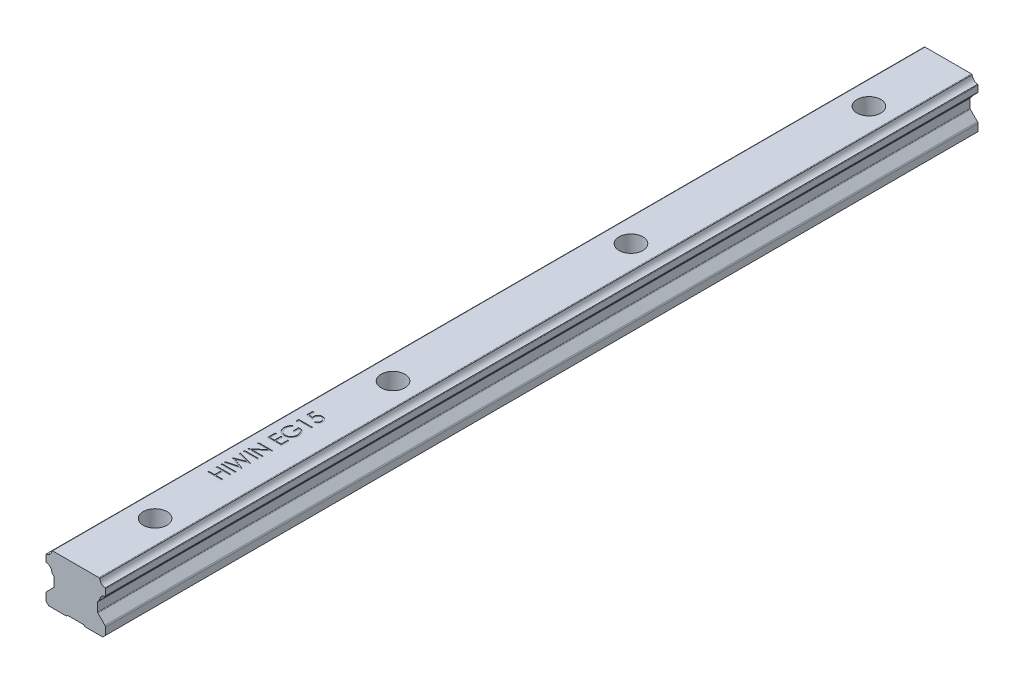
from build123d import *

# Parameters (mm, degrees)
EXTRUDE_1_DEPTH              = 220
HOLE_WIZARD_M3_1_D           = 3.5
HOLE_WIZARD_M3_1_CBORE_D     = 6
HOLE_WIZARD_M3_1_CBORE_DEPTH = 4.5
PATTERN_LINEAR_1_COUNT       = 4
PATTERN_LINEAR_1_PITCH       = 60
SKETCH_6_W                   = 3.5
SKETCH_6_H                   = 0.314102564
CUT_EXTRUDE_1_DEPTH          = 0.1


with BuildPart() as part:
    # 草图1 → 凸台-拉伸1 (new body)
    with BuildSketch(Plane.XY):
        with BuildLine():
            Line((7.5, 9.369442683), (7.5, 10.830565317))
            ThreePointArc((7.5, 10.830565317), (7.479698939, 10.939048053), (7.421543308, 11.032848691))
            ThreePointArc((7.421543308, 11.032848691), (6.468331206, 11.468335206), (6.03284469, 12.421547308))
            ThreePointArc((6.03284469, 12.421547308), (5.939044052, 12.479702939), (5.830561317, 12.500004))
            Line((5.830561317, 12.500004), (-5.830561317, 12.500004))
            ThreePointArc((-5.830561317, 12.500004), (-5.939044052, 12.479702939), (-6.03284469, 12.421547308))
            ThreePointArc((-6.03284469, 12.421547308), (-6.468331206, 11.468335206), (-7.421543307, 11.03284869))
            ThreePointArc((-7.421543307, 11.03284869), (-7.479698938, 10.939048053), (-7.5, 10.830565317))
            Line((-7.5, 10.830565317), (-7.5, 9.369442683))
            ThreePointArc((-7.5, 9.369442683), (-7.479698938, 9.260959948), (-7.421543307, 9.16715931))
            ThreePointArc((-7.421543307, 9.16715931), (-6.419021805, 8.6799564), (-6.029408747, 7.635629965))
            Line((-6.029408747, 7.635629965), (-5.58786755, 7.194087041))
            ThreePointArc((-5.58786755, 7.194087041), (-5.522836028, 7.09676018), (-5.5, 6.981955422))
            Line((-5.5, 6.981955422), (-5.5, 4.824263469))
            ThreePointArc((-5.5, 4.824263469), (-5.52283614, 4.709458439), (-5.587867966, 4.612131434))
            Line((-5.587867966, 4.612131434), (-7.353553391, 2.846446009))
            ThreePointArc((-7.353553391, 2.846446009), (-7.461939766, 2.684234335), (-7.5, 2.492892619))
            Line((-7.5, 2.492892619), (-7.5, 0.700010907))
            Line((-7.5, 0.700010907), (-6.79998907, 0))
            Line((-6.79998907, 0), (-2.3500088, 0))
            Line((-2.3500088, 0), (-2.05000999, 0.29999924))
            Line((-2.05000999, 0.29999924), (2.05000999, 0.29999924))
            Line((2.05000999, 0.29999924), (2.3500088, 0))
            Line((2.3500088, 0), (6.79998907, 0))
            Line((6.79998907, 0), (7.5, 0.700010907))
            Line((7.5, 0.700010907), (7.5, 2.492892619))
            ThreePointArc((7.5, 2.492892619), (7.461939766, 2.684234335), (7.353553391, 2.84644601))
            Line((7.353553391, 2.84644601), (5.587867966, 4.612131434))
            ThreePointArc((5.587867966, 4.612131434), (5.522836141, 4.709458439), (5.5, 4.824263469))
            Line((5.5, 4.824263469), (5.5, 6.981955422))
            ThreePointArc((5.5, 6.981955422), (5.522836028, 7.09676018), (5.587867551, 7.194087041))
            Line((5.587867551, 7.194087041), (6.029408747, 7.635629965))
            ThreePointArc((6.029408747, 7.635629965), (6.419021805, 8.6799564), (7.421543308, 9.16715931))
            ThreePointArc((7.421543308, 9.16715931), (7.479698939, 9.260959948), (7.5, 9.369442683))
        make_face()
    extrude(amount=-EXTRUDE_1_DEPTH)

    # M3 六角凹头螺钉的柱形沉头孔1 (through all)
    with Locations(Plane(origin=(1.396551685, 12.500004, 9.221659416), x_dir=(-1, 0, 0), z_dir=(0, 1, 0))):
        with Locations((1.396551685, -29.221659416)):
            hole_wizard_m3_1 = CounterBoreHole(HOLE_WIZARD_M3_1_D / 2, HOLE_WIZARD_M3_1_CBORE_D / 2, HOLE_WIZARD_M3_1_CBORE_DEPTH)

    # 阵列(线性)1: M3 六角凹头螺钉的柱形沉头孔1 ×4
    with Locations(*[(0, 0, -i * PATTERN_LINEAR_1_PITCH) for i in range(1, PATTERN_LINEAR_1_COUNT)]):
        add(hole_wizard_m3_1, mode=Mode.SUBTRACT)

    # 草图6 → 切除-拉伸1 (cut)
    with BuildSketch(Plane(origin=(0, 12.500004, 0), x_dir=(1, 0, 0), z_dir=(0, 1, 0))):
        Polygon((-3.5, 36.762820513), (-3.5, 37.076923077), (-2.064102564, 37.076923077), (-2.064102564, 38.871794872), (-3.5, 38.871794872), (-3.5, 39.185897436), (0, 39.185897436), (0, 38.871794872), (-1.705128205, 38.871794872), (-1.705128205, 37.076923077), (0, 37.076923077), (0, 36.762820513), align=None)
        with Locations((-1.75, 40.240384615)):
            Rectangle(SKETCH_6_W, SKETCH_6_H)
        Polygon((-3.5, 40.935897436), (-3.5, 41.260516827), (-0.933193109, 41.945512821), (-3.5, 42.964242788), (-3.5, 43.009815705), (-0.950721154, 44.009615385), (-3.5, 44.698116987), (-3.5, 45.019230769), (0, 44.075520833), (0, 44.030649038), (-2.676883013, 42.977564103), (0, 41.911858974), (0, 41.866987179), align=None)
        with Locations((-1.75, 45.983974359)):
            Rectangle(SKETCH_6_W, SKETCH_6_H)
        Polygon((0, 46.903846154), (-3.5, 46.903846154), (-3.5, 46.969751603), (-0.745292468, 49.282051282), (-3.5, 49.282051282), (-3.5, 49.596153846), (0, 49.596153846), (0, 49.524639423), (-2.748397436, 47.217948718), (0, 47.217948718), align=None)
        Polygon((-3.5, 51.83974359), (-3.5, 53.814102564), (-3.141025641, 53.814102564), (-3.141025641, 52.153846154), (-2.064102564, 52.153846154), (-2.064102564, 53.814102564), (-1.705128205, 53.814102564), (-1.705128205, 52.153846154), (-0.358974359, 52.153846154), (-0.358974359, 53.814102564), (0, 53.814102564), (0, 51.83974359), align=None)
        with BuildLine():
            Line((-2.902644231, 57.717948718), (-2.647435897, 57.448717949))
            add(Edge.make_bspline(
                [(-2.647435897, 57.448717949), (-2.69328212, 57.400008868), (-2.783881335, 57.303752203), (-2.901244074, 57.146552261), (-3.002777003, 56.983196408), (-3.084772592, 56.813420508), (-3.149094254, 56.641676508), (-3.195850217, 56.470917554), (-3.225460377, 56.302249256), (-3.229016796, 56.190084954), (-3.230769231, 56.134815705)],
                knots=[0, 0, 0, 0, 1.089067066, 2.152164705, 3.18986567, 4.218445106, 5.218487318, 6.173592265, 7.100032889, 8, 8, 8, 8], degree=3))
            add(Edge.make_bspline(
                [(-3.230769231, 56.134815705), (-3.230355625, 56.100901005), (-3.229529486, 56.033159565), (-3.218985271, 55.932537621), (-3.203820407, 55.832970983), (-3.181878529, 55.734647609), (-3.15406947, 55.637376321), (-3.119284004, 55.541495434), (-3.078728771, 55.446826062), (-3.031866252, 55.354260043), (-2.980386575, 55.26451931), (-2.923337414, 55.179763314), (-2.862550889, 55.099446852), (-2.796491613, 55.025097645), (-2.725807311, 54.956221131), (-2.651770944, 54.89155043), (-2.572926872, 54.832290852), (-2.489599321, 54.779505212), (-2.403726867, 54.731837618), (-2.316037795, 54.690645418), (-2.227346143, 54.654835464), (-2.136984078, 54.627561503), (-2.045883197, 54.604460629), (-1.953566086, 54.588379393), (-1.859791669, 54.579283076), (-1.796993971, 54.577712585), (-1.765424679, 54.576923077)],
                knots=[0, 0, 0, 0, 1.028150113, 2.053633673, 3.06513288, 4.081487945, 5.106702018, 6.131327874, 7.172780699, 8.228344599, 9.276313556, 10.308389736, 11.324843658, 12.329040066, 13.321460474, 14.316307835, 15.308626991, 16.309440696, 17.305625405, 18.28535951, 19.246194545, 20.203493668, 21.145557131, 22.095268976, 23.042464743, 24, 24, 24, 24], degree=3))
            add(Edge.make_bspline(
                [(-1.765424679, 54.576923077), (-1.733154018, 54.577679272), (-1.668700816, 54.579189598), (-1.572504414, 54.588842795), (-1.477747832, 54.606798005), (-1.384282029, 54.630609755), (-1.291920993, 54.66088243), (-1.20076111, 54.698074944), (-1.110811241, 54.742381076), (-1.022964324, 54.793552345), (-0.937464192, 54.850061813), (-0.856251713, 54.912212997), (-0.780271995, 54.980110534), (-0.708415252, 55.052509477), (-0.641134974, 55.130069473), (-0.579242122, 55.213543005), (-0.521779643, 55.301761597), (-0.469378807, 55.394764386), (-0.42257144, 55.491568366), (-0.38094723, 55.590824797), (-0.346667976, 55.692852699), (-0.31872985, 55.797115365), (-0.295829559, 55.903488643), (-0.281097077, 56.012512444), (-0.270406246, 56.123385153), (-0.269624576, 56.198123785), (-0.269230769, 56.235777244)],
                knots=[0, 0, 0, 0, 0.935915162, 1.869274651, 2.799799983, 3.730201895, 4.664668062, 5.616159355, 6.583070886, 7.570012957, 8.562524459, 9.553461134, 10.53281078, 11.515274572, 12.509912756, 13.507571325, 14.526460018, 15.561318395, 16.601025881, 17.643204557, 18.680545676, 19.719612342, 20.772381578, 21.833430283, 22.908478249, 24, 24, 24, 24], degree=3))
            add(Edge.make_bspline(
                [(-0.269230769, 56.235777244), (-0.270178952, 56.281155776), (-0.272040863, 56.370263896), (-0.286546735, 56.501247716), (-0.309173205, 56.627060334), (-0.342412256, 56.747292172), (-0.384484705, 56.862379567), (-0.436513285, 56.971898055), (-0.497950569, 57.076150049), (-0.567552463, 57.174684309), (-0.645100929, 57.26515833), (-0.728035637, 57.347500409), (-0.817431068, 57.418879031), (-0.911954918, 57.481426348), (-1.012511326, 57.533123592), (-1.118540888, 57.57556947), (-1.230109213, 57.608101926), (-1.307200733, 57.621457015), (-1.346153846, 57.628205128)],
                knots=[0, 0, 0, 0, 1.130199668, 2.219330667, 3.279027493, 4.311506524, 5.322739849, 6.327972234, 7.327472899, 8.33386792, 9.329086447, 10.29244429, 11.240784345, 12.174119183, 13.111530729, 14.052100829, 15.015757696, 16, 16, 16, 16], degree=3))
            Line((-1.346153846, 57.628205128), (-1.346153846, 56.461538462))
            Line((-1.346153846, 56.461538462), (-1.705128205, 56.461538462))
            Line((-1.705128205, 56.461538462), (-1.705128205, 57.942307692))
            add(Edge.make_bspline(
                [(-1.705128205, 57.942307692), (-1.638220716, 57.940601844), (-1.507270675, 57.937263191), (-1.316300404, 57.913844275), (-1.13592871, 57.876027763), (-0.965965639, 57.824367451), (-0.806652046, 57.75749217), (-0.65782618, 57.676119642), (-0.520449499, 57.578947521), (-0.393400495, 57.469437079), (-0.280071283, 57.346537122), (-0.180465345, 57.213568502), (-0.09656273, 57.070311533), (-0.028302067, 56.916901726), (0.024971927, 56.753841292), (0.062743504, 56.580752913), (0.085373467, 56.397871312), (0.088264847, 56.272534635), (0.08974359, 56.208433494)],
                knots=[0, 0, 0, 0, 1.140356446, 2.231883559, 3.274166699, 4.278491846, 5.25512956, 6.21435461, 7.1637429, 8.11826594, 9.068280886, 10.0076534, 10.945064095, 11.891975133, 12.864533718, 13.863980011, 14.907571808, 16, 16, 16, 16], degree=3))
            add(Edge.make_bspline(
                [(0.08974359, 56.208433494), (0.089174469, 56.168923358), (0.088051978, 56.090996637), (0.080074631, 55.975905709), (0.067794054, 55.863988089), (0.049248931, 55.75526008), (0.026534277, 55.649321738), (-0.002552442, 55.546702153), (-0.036221141, 55.447010411), (-0.074516815, 55.350092425), (-0.118888472, 55.256827878), (-0.168198111, 55.166801361), (-0.222191472, 55.079515236), (-0.281802318, 54.995564071), (-0.346584778, 54.914510449), (-0.416668697, 54.836877005), (-0.491839816, 54.762229127), (-0.545218826, 54.715468664), (-0.572115385, 54.691907051)],
                knots=[0, 0, 0, 0, 1.107784379, 2.184907829, 3.233506516, 4.263428166, 5.276301166, 6.270063455, 7.25232949, 8.225834625, 9.190232166, 10.146266622, 11.1027726, 12.066435141, 13.031522626, 14.010570082, 14.99756817, 16, 16, 16, 16], degree=3))
            add(Edge.make_bspline(
                [(-0.572115385, 54.691907051), (-0.614786038, 54.657721119), (-0.699419055, 54.589916707), (-0.835018999, 54.50263855), (-0.975420859, 54.428237147), (-1.121015488, 54.367869325), (-1.271666701, 54.320731239), (-1.427181992, 54.286924986), (-1.587761622, 54.267117697), (-1.696426887, 54.264264159), (-1.751402244, 54.262820513)],
                knots=[0, 0, 0, 0, 1.023165419, 2.029347347, 3.013907458, 3.994755782, 4.975994455, 5.96558838, 6.970761222, 8, 8, 8, 8], degree=3))
            add(Edge.make_bspline(
                [(-1.751402244, 54.262820513), (-1.792568496, 54.263352751), (-1.874377804, 54.264410462), (-1.99583511, 54.27723598), (-2.115135808, 54.295637392), (-2.232182344, 54.322684468), (-2.347053012, 54.356780654), (-2.45980069, 54.399334435), (-2.570493643, 54.448878213), (-2.67836343, 54.50646793), (-2.782003044, 54.570536667), (-2.880905313, 54.640144323), (-2.973467332, 54.715828008), (-3.059903521, 54.797808103), (-3.141494975, 54.884432033), (-3.216537375, 54.977518334), (-3.286205011, 55.07565667), (-3.349159221, 55.17960781), (-3.405727075, 55.287731441), (-3.455315154, 55.399792527), (-3.496298775, 55.515750345), (-3.531072472, 55.634737902), (-3.556787635, 55.757655381), (-3.575436374, 55.883610924), (-3.588196976, 56.013261034), (-3.589223231, 56.100897064), (-3.58974359, 56.145332532)],
                knots=[0, 0, 0, 0, 1.00895651, 2.005089799, 2.991467152, 3.967318338, 4.948153826, 5.927364234, 6.919980553, 7.91976625, 8.923240147, 9.905815003, 10.88314567, 11.851989312, 12.825009789, 13.798721852, 14.781296708, 15.773896486, 16.776076962, 17.771600213, 18.775744723, 19.78957137, 20.808953803, 21.851964491, 22.910847925, 24, 24, 24, 24], degree=3))
            add(Edge.make_bspline(
                [(-3.58974359, 56.145332532), (-3.589164098, 56.181570776), (-3.588015034, 56.253426954), (-3.580050386, 56.360352687), (-3.567426505, 56.465625701), (-3.550199718, 56.569402091), (-3.526736028, 56.671328458), (-3.498657743, 56.771695163), (-3.46596592, 56.870647699), (-3.426977074, 56.967875948), (-3.382723449, 57.064033664), (-3.332910027, 57.159655505), (-3.276685022, 57.254414751), (-3.213881487, 57.348475732), (-3.145578069, 57.44243159), (-3.069821245, 57.534796233), (-2.989598489, 57.627799177), (-2.931916305, 57.687600991), (-2.902644231, 57.717948718)],
                knots=[0, 0, 0, 0, 0.985871117, 1.954866573, 2.915460327, 3.869826059, 4.81536089, 5.759505086, 6.70452669, 7.649098992, 8.607881297, 9.583363685, 10.581137262, 11.603961102, 12.659522466, 13.73993555, 14.853081303, 16, 16, 16, 16], degree=3))
        make_face()
        Polygon((-3.5, 59.090044071), (-3.5, 59.737179487), (0, 59.737179487), (0, 59.423076923), (-3.141025641, 59.423076923), (-3.141025641, 58.884615385), align=None)
        with BuildLine():
            Line((-3.5, 63.237179487), (-3.141025641, 63.237179487))
            Line((-3.141025641, 63.237179487), (-3.141025641, 62.046674679))
            Line((-3.141025641, 62.046674679), (-2.220452724, 61.858072917))
            add(Edge.make_bspline(
                [(-2.220452724, 61.858072917), (-2.230682996, 61.895128791), (-2.25050253, 61.966918687), (-2.2725083, 62.072878548), (-2.285773744, 62.173470751), (-2.287585055, 62.238746122), (-2.288461538, 62.270332532)],
                knots=[0, 0, 0, 0, 1.100273476, 2.13160584, 3.095893838, 4, 4, 4, 4], degree=3))
            add(Edge.make_bspline(
                [(-2.288461538, 62.270332532), (-2.28764354, 62.309423446), (-2.28603515, 62.38628595), (-2.269673986, 62.498570255), (-2.245976174, 62.606297591), (-2.209465207, 62.707877373), (-2.164878805, 62.804916696), (-2.108721258, 62.895749027), (-2.04315746, 62.981649201), (-1.968525078, 63.06202352), (-1.885534459, 63.134596519), (-1.795933934, 63.197660062), (-1.701678739, 63.252702837), (-1.600559725, 63.295631262), (-1.494484031, 63.330665044), (-1.382227183, 63.353766408), (-1.264785773, 63.369197118), (-1.18448027, 63.370917558), (-1.143529647, 63.371794872)],
                knots=[0, 0, 0, 0, 1.052805225, 2.070078116, 3.052532748, 4.020689046, 4.973125432, 5.925915817, 6.89216474, 7.881560752, 8.877013184, 9.857446635, 10.830895175, 11.812622661, 12.812548702, 13.836681939, 14.896847428, 16, 16, 16, 16], degree=3))
            add(Edge.make_bspline(
                [(-1.143529647, 63.371794872), (-1.115007605, 63.371129197), (-1.058348972, 63.369806845), (-0.974202158, 63.363097041), (-0.891849045, 63.350128648), (-0.811440613, 63.332928531), (-0.732901554, 63.309967224), (-0.65579213, 63.283109802), (-0.580956685, 63.249727804), (-0.508064701, 63.21272013), (-0.437950402, 63.171741106), (-0.372294905, 63.125661103), (-0.309599937, 63.077781326), (-0.251727444, 63.02546383), (-0.198452948, 62.969303437), (-0.149513072, 62.909612628), (-0.104029493, 62.846932808), (-0.063861909, 62.780276778), (-0.026898788, 62.711134508), (0.003424705, 62.638506234), (0.030535245, 62.564045549), (0.05214477, 62.486680669), (0.069077325, 62.406586858), (0.080577925, 62.323632082), (0.088954363, 62.238251412), (0.08947872, 62.180376399), (0.08974359, 62.151141827)],
                knots=[0, 0, 0, 0, 1.056393913, 2.098511576, 3.122979385, 4.141471433, 5.141222888, 6.151259816, 7.162667642, 8.172852865, 9.177685681, 10.166741883, 11.141342384, 12.097242845, 13.052202613, 14.005160326, 14.953864445, 15.917140761, 16.884916217, 17.854238259, 18.828761908, 19.81781811, 20.826036654, 21.857789401, 22.917898972, 24, 24, 24, 24], degree=3))
            add(Edge.make_bspline(
                [(0.08974359, 62.151141827), (0.089050894, 62.116268535), (0.087688097, 62.047659454), (0.073496095, 61.947126211), (0.053035464, 61.850457897), (0.022721931, 61.758068818), (-0.016971483, 61.670344289), (-0.064133263, 61.586028116), (-0.12027864, 61.506165359), (-0.184894072, 61.431302018), (-0.255892818, 61.362486012), (-0.332202561, 61.300083151), (-0.413920487, 61.245219514), (-0.500780871, 61.197696086), (-0.592629648, 61.157210456), (-0.689749822, 61.12539205), (-0.791650601, 61.099714631), (-0.861804004, 61.088851082), (-0.897435897, 61.083333333)],
                knots=[0, 0, 0, 0, 1.046872515, 2.059598001, 3.044168548, 4.012104806, 4.973680974, 5.932408326, 6.910122221, 7.900780896, 8.89867654, 9.876692837, 10.858029398, 11.85084981, 12.847361615, 13.868568023, 14.917415949, 16, 16, 16, 16], degree=3))
            Line((-0.897435897, 61.083333333), (-0.897435897, 61.397435897))
            add(Edge.make_bspline(
                [(-0.897435897, 61.397435897), (-0.86405597, 61.40515962), (-0.799897896, 61.420005043), (-0.709812799, 61.452675135), (-0.62950762, 61.4922321), (-0.558491359, 61.540366037), (-0.495464081, 61.596159433), (-0.43989307, 61.661016372), (-0.389697273, 61.733315452), (-0.347784769, 61.813697831), (-0.312479137, 61.898665893), (-0.287283878, 61.987088992), (-0.272032646, 62.077694545), (-0.270168243, 62.138697165), (-0.269230769, 62.169370994)],
                knots=[0, 0, 0, 0, 1.13623081, 2.183898708, 3.172478118, 4.09966615, 5.022692284, 5.957376522, 6.927682873, 7.937366477, 8.960015386, 9.976409503, 10.982481913, 12, 12, 12, 12], degree=3))
            add(Edge.make_bspline(
                [(-0.269230769, 62.169370994), (-0.270058415, 62.199326897), (-0.271688055, 62.258310315), (-0.284028564, 62.345158154), (-0.303533592, 62.428761408), (-0.33085902, 62.509268484), (-0.367008958, 62.586283786), (-0.411417074, 62.659698422), (-0.462975425, 62.730558248), (-0.521904738, 62.796998341), (-0.586881759, 62.857834583), (-0.656357238, 62.911591543), (-0.730474586, 62.956368236), (-0.807947606, 62.994102404), (-0.889626199, 63.022755687), (-0.975127364, 63.043196672), (-1.064662347, 63.05519973), (-1.125731657, 63.05685091), (-1.156850962, 63.057692308)],
                knots=[0, 0, 0, 0, 1.027268864, 2.022700798, 3.002744649, 3.968653148, 4.933396556, 5.915045722, 6.907600446, 7.935526002, 8.956456544, 9.95700807, 10.942805781, 11.92166854, 12.907987664, 13.905483474, 14.932689774, 16, 16, 16, 16], degree=3))
            add(Edge.make_bspline(
                [(-1.156850962, 63.057692308), (-1.184930032, 63.057053836), (-1.239659043, 63.055809387), (-1.320009695, 63.045036283), (-1.396158478, 63.027039982), (-1.468436727, 63.001416905), (-1.536613353, 62.969438486), (-1.600538112, 62.929288612), (-1.660812066, 62.882676899), (-1.715884112, 62.82825878), (-1.766793088, 62.769063131), (-1.810034281, 62.703569507), (-1.846807397, 62.633526342), (-1.876936465, 62.558803838), (-1.900936575, 62.479309952), (-1.917523378, 62.395001869), (-1.92744867, 62.305860374), (-1.928795087, 62.24488473), (-1.929487179, 62.213541667)],
                knots=[0, 0, 0, 0, 1.045723156, 2.038222538, 3.013889863, 3.95567481, 4.890389958, 5.81331128, 6.76251276, 7.723027653, 8.692928204, 9.666105983, 10.639751036, 11.635719707, 12.66315958, 13.728667616, 14.832476222, 16, 16, 16, 16], degree=3))
            add(Edge.make_bspline(
                [(-1.929487179, 62.213541667), (-1.928906588, 62.186412738), (-1.927707815, 62.130398383), (-1.918881318, 62.044475556), (-1.904642024, 61.954183833), (-1.885055776, 61.859869337), (-1.859424699, 61.761248829), (-1.828710199, 61.658530428), (-1.7919882, 61.551498162), (-1.764255986, 61.479380437), (-1.75, 61.442307692)],
                knots=[0, 0, 0, 0, 0.817624296, 1.688186739, 2.600797293, 3.572016777, 4.590301741, 5.671205678, 6.80286297, 8, 8, 8, 8], degree=3))
            Line((-1.75, 61.442307692), (-3.5, 61.801282051))
            Line((-3.5, 61.801282051), (-3.5, 63.237179487))
        make_face()
    extrude(amount=-CUT_EXTRUDE_1_DEPTH, mode=Mode.SUBTRACT)


solid = part.part
